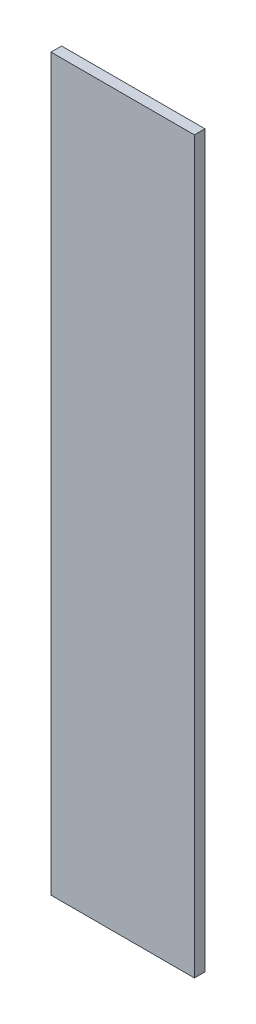
from build123d import *

# Parameters (mm, degrees)
SKETCH1_W           = 13.79140625
SKETCH1_H           = 70.241848594
BOSS_EXTRUDE1_DEPTH = 1.016


with BuildPart() as part:
    # Sketch1 → Boss-Extrude1 (new body)
    with BuildSketch(Plane.XY):
        with Locations((6.895703125, 35.120924297)):
            Rectangle(SKETCH1_W, SKETCH1_H)
    extrude(amount=BOSS_EXTRUDE1_DEPTH)


solid = part.part
